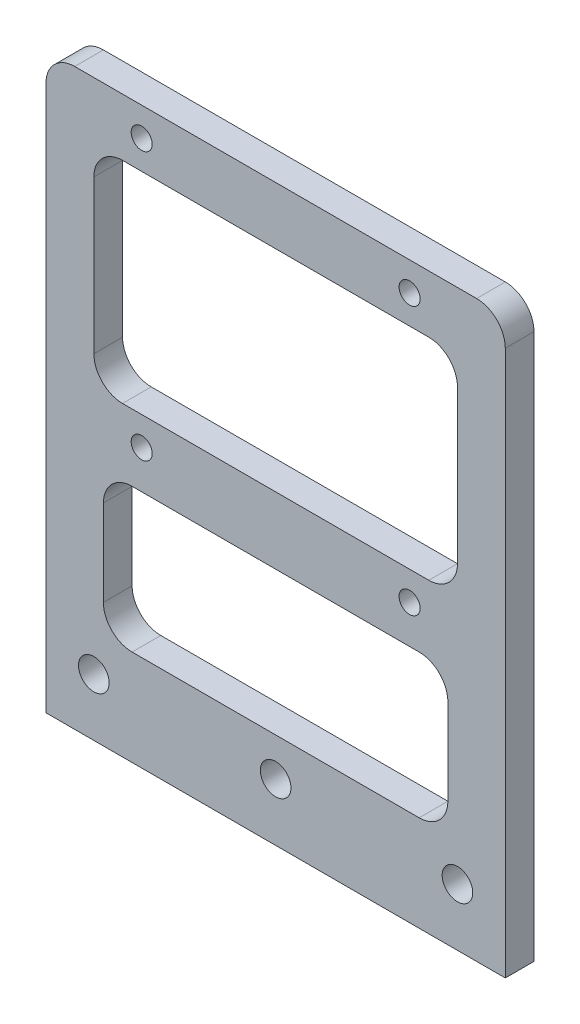
from build123d import *

# Parameters (mm, degrees)
SKETCH_1_W      = 48
SKETCH_1_H      = 60
SKETCH_1_R      = 1.6
SKETCH_1_R_2    = 1.1
SKETCH_1_W_2    = 38
SKETCH_1_H_2    = 22
EXTRUDE_1_DEPTH = 3
FILLET_1_R      = 3
FILLET_2_R      = 3


with BuildPart() as part:
    # 草图1 → 凸台-拉伸1 (new body)
    with BuildSketch(Plane.XY):
        with Locations((0, 30)):
            Rectangle(SKETCH_1_W, SKETCH_1_H)
        with Locations((0, 6)):
            Circle(SKETCH_1_R, mode=Mode.SUBTRACT)
        with Locations((-19, 6)):
            Circle(SKETCH_1_R, mode=Mode.SUBTRACT)
        with Locations((19, 6)):
            Circle(SKETCH_1_R, mode=Mode.SUBTRACT)
        with Locations((-14, 57)):
            Circle(SKETCH_1_R_2, mode=Mode.SUBTRACT)
        with Locations((-14, 29)):
            Circle(SKETCH_1_R_2, mode=Mode.SUBTRACT)
        with Locations((14, 57)):
            Circle(SKETCH_1_R_2, mode=Mode.SUBTRACT)
        with Locations((14, 29)):
            Circle(SKETCH_1_R_2, mode=Mode.SUBTRACT)
        Polygon((-18, 10), (-3.79137849, 10), (3.79137849, 10), (18, 10), (18, 25), (-18, 25), align=None, mode=Mode.SUBTRACT)
        with Locations((0, 43)):
            Rectangle(SKETCH_1_W_2, SKETCH_1_H_2, mode=Mode.SUBTRACT)
    extrude(amount=EXTRUDE_1_DEPTH)

    # 圆角1
    fillet_1_edges = [part.edges().sort_by_distance(p)[0] for p in [
        (19, 32, 1.5),
        (19, 54, 1.5),
        (-19, 54, 1.5),
        (-19, 32, 1.5),
        (-24, 60, 1.5),
        (24, 60, 1.5),
    ]]
    fillet(fillet_1_edges, radius=FILLET_1_R)

    # 圆角2
    fillet_2_edges = [part.edges().sort_by_distance(p)[0] for p in [
        (-18, 25, 1.5),
        (-18, 10, 1.5),
        (18, 10, 1.5),
        (18, 25, 1.5),
    ]]
    fillet(fillet_2_edges, radius=FILLET_2_R)


solid = part.part
